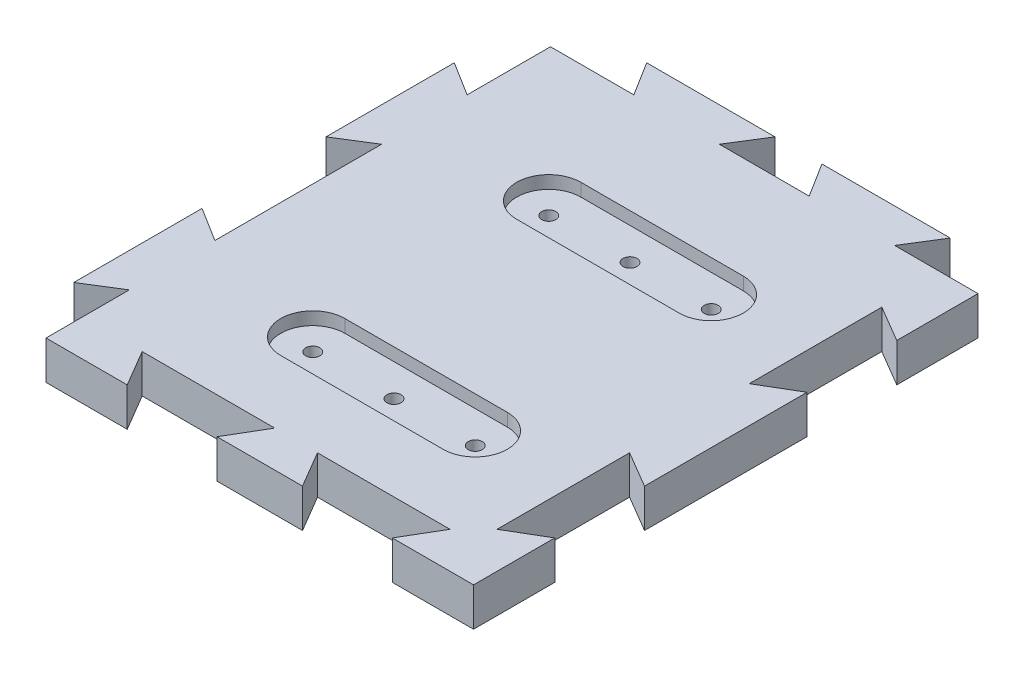
from build123d import *

# Parameters (mm, degrees)
SKETCH2_R           = 1.65
BOSS_EXTRUDE2_DEPTH = 9
CUT_EXTRUDE1_DEPTH  = 3


with BuildPart() as part:
    # Sketch2 → Boss-Extrude2 (new body)
    with BuildSketch(Plane(origin=(0, 0, 0), x_dir=(1, 0, 0), z_dir=(0, 1, 0))):
        Polygon((0, 98.5), (-8, 103.5), (-8, 73.5), (0, 78.5), (0, 39.5), (-8, 44.5), (-8, 14.5), (0, 19.5), (0, 0), (19, 0), (14, 8.5), (45, 8.5), (40, 0), (60, 0), (55, 8.5), (86, 8.5), (81, 0), (100, 0), (100, 19), (91.5, 14), (91.5, 45), (100, 40), (100, 78), (91.5, 73), (91.5, 104), (100, 99), (100, 118), (80.5, 118), (85.5, 126), (55.5, 126), (60.5, 118), (39.5, 118), (44.5, 126), (14.5, 126), (19.5, 118), (0, 118), align=None)
        with Locations(Location((31, 31.4, 0), (0, 0, 270))):
            Circle(SKETCH2_R, mode=Mode.SUBTRACT)
        with Locations(Location((31, 86.6, 0), (0, 0, 270))):
            Circle(SKETCH2_R, mode=Mode.SUBTRACT)
        with Locations(Location((50, 31.4, 0), (0, 0, 270))):
            Circle(SKETCH2_R, mode=Mode.SUBTRACT)
        with Locations(Location((50, 86.6, 0), (0, 0, 270))):
            Circle(SKETCH2_R, mode=Mode.SUBTRACT)
        with Locations(Location((69, 31.4, 0), (0, 0, 270))):
            Circle(SKETCH2_R, mode=Mode.SUBTRACT)
        with Locations(Location((69, 86.6, 0), (0, 0, 270))):
            Circle(SKETCH2_R, mode=Mode.SUBTRACT)
    extrude(amount=BOSS_EXTRUDE2_DEPTH)

    # Sketch4 → Cut-Extrude1 (cut)
    with BuildSketch(Plane(origin=(0, 9, 0), x_dir=(1, 0, 0), z_dir=(0, 1, 0))):
        with BuildLine():
            Line((31, 94.1), (69, 94.1))
            ThreePointArc((69, 94.1), (76.5, 86.6), (69, 79.1))
            Line((69, 79.1), (31, 79.1))
            ThreePointArc((31, 79.1), (23.5, 86.6), (31, 94.1))
        make_face()
        with BuildLine():
            Line((31, 38.9), (69, 38.9))
            ThreePointArc((69, 38.9), (76.5, 31.4), (69, 23.9))
            Line((69, 23.9), (31, 23.9))
            ThreePointArc((31, 23.9), (23.5, 31.4), (31, 38.9))
        make_face()
    extrude(amount=-CUT_EXTRUDE1_DEPTH, mode=Mode.SUBTRACT)


solid = part.part
